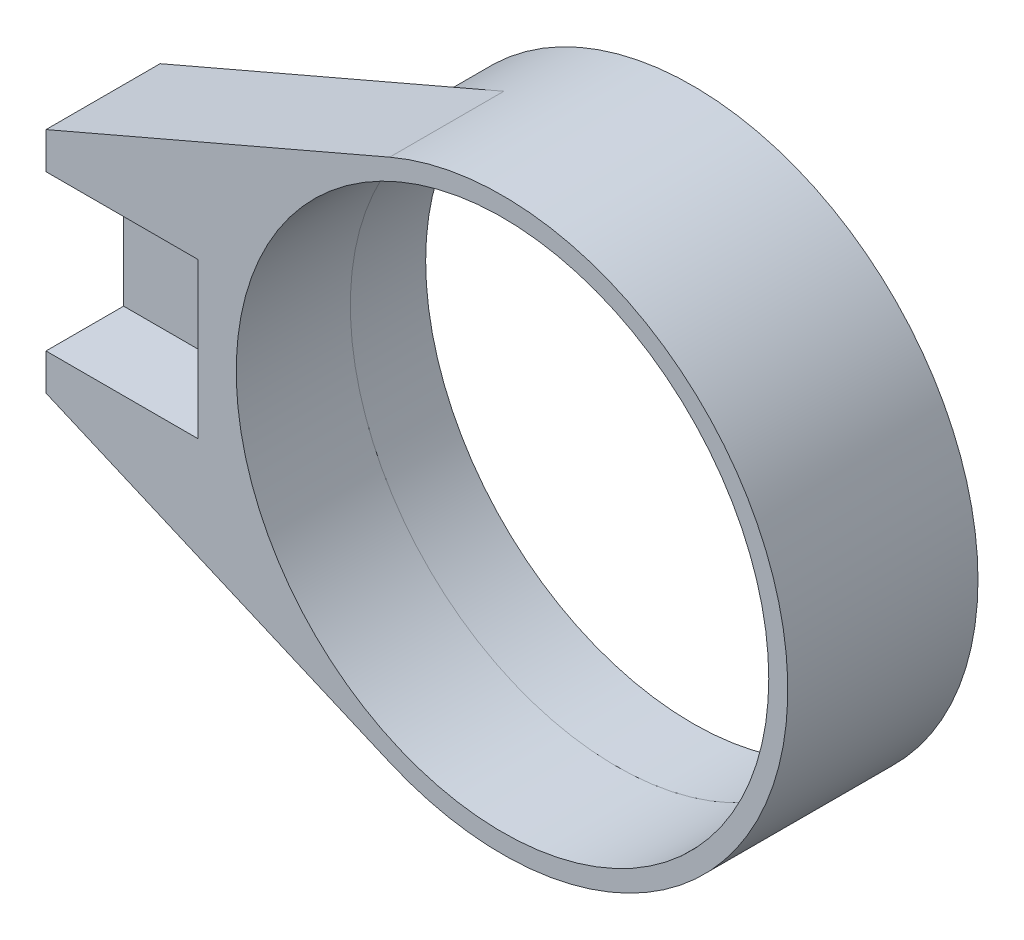
from build123d import *

# Parameters (mm, degrees)
ESQUISSE1_R             = 37.5
ESQUISSE1_R_2           = 35.1
BOSS_EXTRU_1_DEPTH      = 10
ESQUISSE2_R             = 35
BOSS_EXTRU_2_DEPTH      = 15
ESQUISSE6_W             = 10.2
ESQUISSE6_H             = 20.4
ENL_V_MAT_EXTRU_1_DEPTH = 20


with BuildPart() as part:
    # Esquisse1 → Boss.-Extru.1 (new body)
    with BuildSketch(Plane.XY):
        Circle(ESQUISSE1_R)
        Circle(ESQUISSE1_R_2, mode=Mode.SUBTRACT)
    extrude(amount=BOSS_EXTRU_1_DEPTH)

    # Esquisse2 → Boss.-Extru.2 (add)
    with BuildSketch(Plane.XY.offset(10)):
        with BuildLine():
            Line((-60, -15), (-60, 15))
            Line((-60, 15), (-14.826354569, 34.444581725))
            ThreePointArc((-14.826354569, 34.444581725), (37.5, 0), (-14.826354569, -34.444581725))
            Line((-14.826354569, -34.444581725), (-60, -15))
        make_face()
        Circle(ESQUISSE2_R, mode=Mode.SUBTRACT)
    extrude(amount=BOSS_EXTRU_2_DEPTH)

    # Esquisse6 → Enlèv. mat.-Extru.1 (cut)
    with BuildSketch(Plane.ZY.offset(60)):
        with Locations((19.9, 0)):
            Rectangle(ESQUISSE6_W, ESQUISSE6_H)
    extrude(amount=-ENL_V_MAT_EXTRU_1_DEPTH, mode=Mode.SUBTRACT)


solid = part.part
